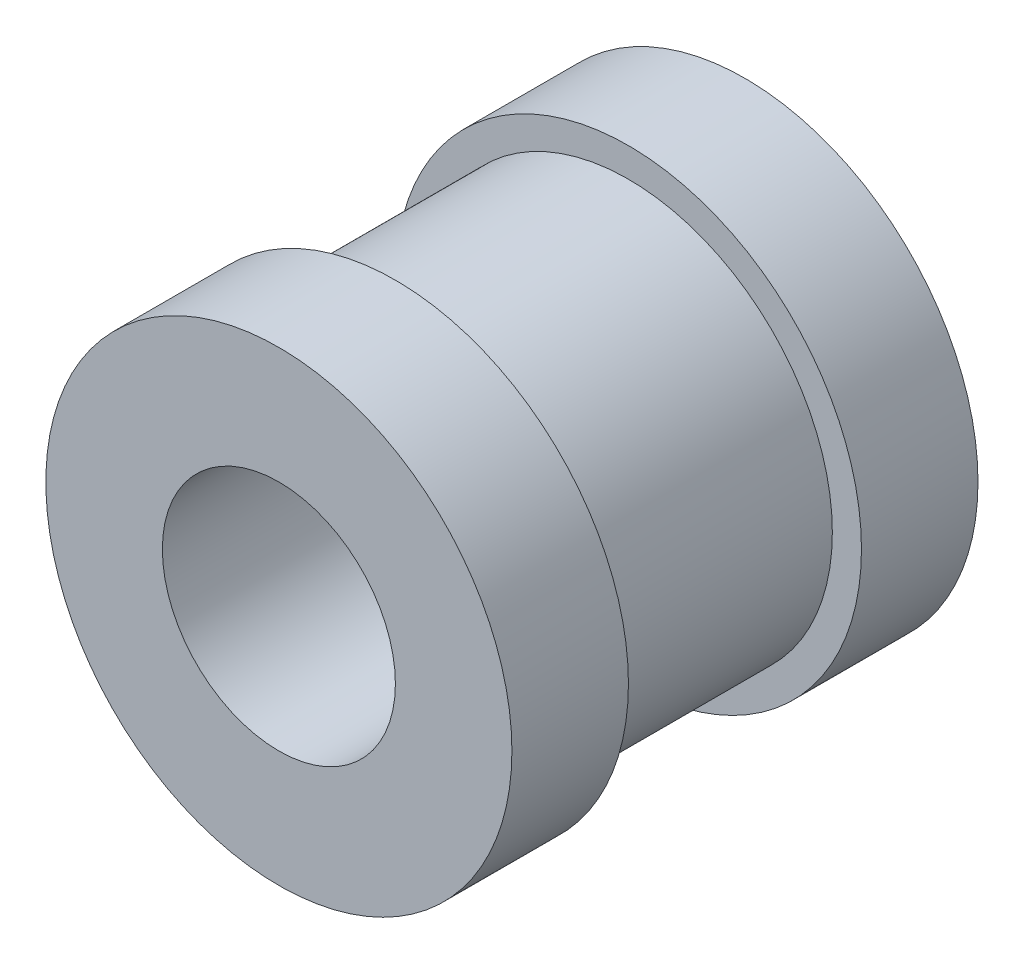
from build123d import *

# Parameters (mm, degrees)
SKETCH1_R           = 10
BOSS_EXTRUDE1_DEPTH = 5
SKETCH2_R           = 8.75
BOSS_EXTRUDE2_DEPTH = 10
SKETCH3_R           = 10
BOSS_EXTRUDE3_DEPTH = 5
SKETCH4_R           = 5
CUT_EXTRUDE1_DEPTH  = 25.494897428


with BuildPart() as part:
    # Sketch1 → Boss-Extrude1 (new body)
    with BuildSketch(Plane.XY):
        Circle(SKETCH1_R)
    extrude(amount=BOSS_EXTRUDE1_DEPTH)

    # Sketch2 → Boss-Extrude2 (add)
    with BuildSketch(Plane.XY.offset(5)):
        Circle(SKETCH2_R)
    extrude(amount=BOSS_EXTRUDE2_DEPTH)

    # Sketch3 → Boss-Extrude3 (add)
    with BuildSketch(Plane.XY.offset(15)):
        Circle(SKETCH3_R)
    extrude(amount=BOSS_EXTRUDE3_DEPTH)

    # Sketch4 → Cut-Extrude1 (cut, through all)
    with BuildSketch(Plane.XY.offset(20)):
        Circle(SKETCH4_R)
    extrude(amount=-CUT_EXTRUDE1_DEPTH, mode=Mode.SUBTRACT)


solid = part.part
